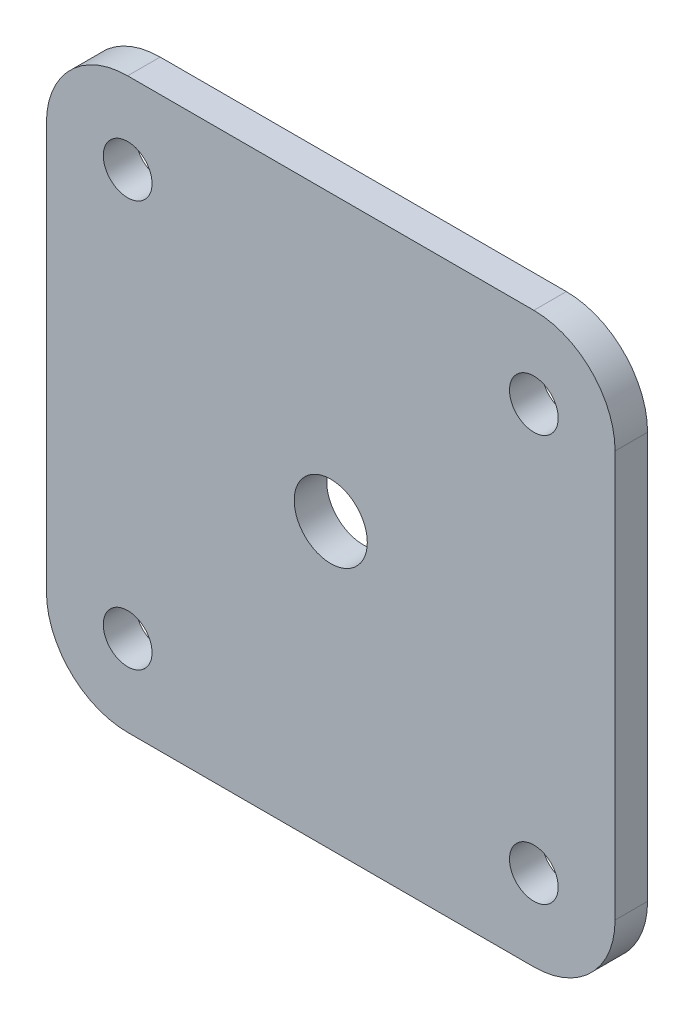
from build123d import *

# Parameters (mm, degrees)
CROQUIS1_W              = 35
CROQUIS1_H              = 35
CROQUIS1_R              = 2.25
SALIENTE_EXTRUIR1_DEPTH = 2
REDONDEO1_R             = 5
CROQUIS2_R              = 1.5
CORTAR_EXTRUIR1_DEPTH   = 25.829418036


with BuildPart() as part:
    # Croquis1 → Saliente-Extruir1 (new body)
    with BuildSketch(Plane.XY):
        Rectangle(CROQUIS1_W, CROQUIS1_H)
        Circle(CROQUIS1_R, mode=Mode.SUBTRACT)
    extrude(amount=SALIENTE_EXTRUIR1_DEPTH)

    # Redondeo1
    redondeo1_edges = [part.edges().sort_by_distance(p)[0] for p in [
        (17.5, -17.5, 1),
        (-17.5, -17.5, 1),
        (-17.5, 17.5, 1),
        (17.5, 17.5, 1),
    ]]
    fillet(redondeo1_edges, radius=REDONDEO1_R)

    # Croquis2 → Cortar-Extruir1 (cut, through all)
    with BuildSketch(Plane.XY.offset(2)):
        with Locations((-12.5, 12.5)):
            Circle(CROQUIS2_R)
        with Locations((12.5, 12.5)):
            Circle(CROQUIS2_R)
        with Locations((12.5, -12.5)):
            Circle(CROQUIS2_R)
        with Locations((-12.5, -12.5)):
            Circle(CROQUIS2_R)
    extrude(amount=-CORTAR_EXTRUIR1_DEPTH, mode=Mode.SUBTRACT)


solid = part.part
